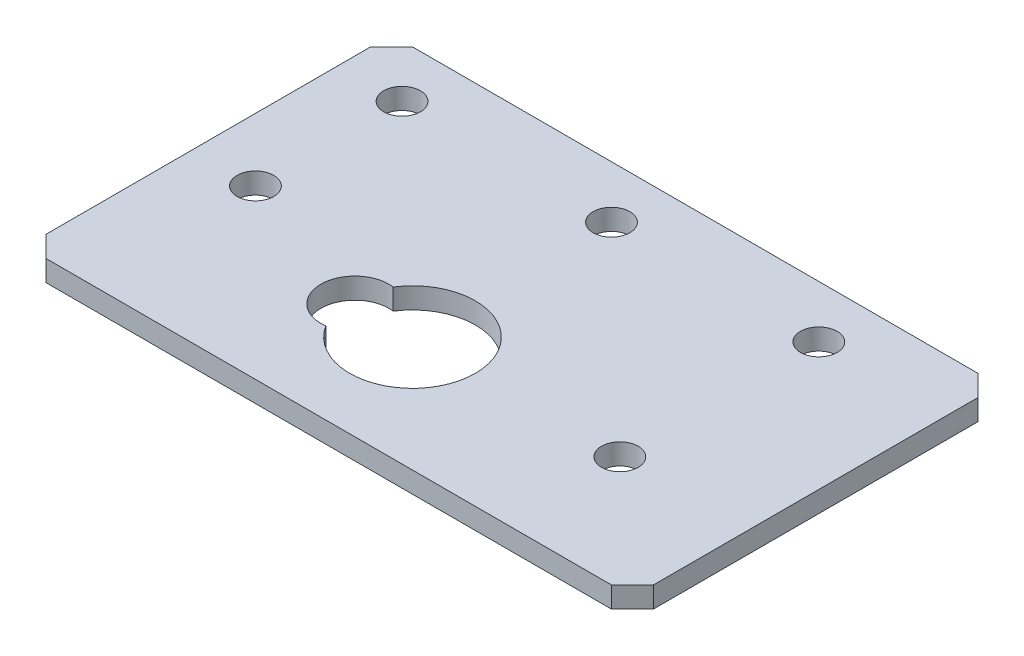
from build123d import *

# Parameters (mm, degrees)
SKETCH1_W                      = 58
SKETCH1_H                      = 35
BOSS_EXTRUDE1_DEPTH            = 2
M3X0_5_TAPPED_HOLE1_AT_2_COUNT = 2
M3X0_5_TAPPED_HOLE1_AT_2_PITCH = 20
M3X0_5_TAPPED_HOLE1_AT_3_COUNT = 2
M3X0_5_TAPPED_HOLE1_AT_3_PITCH = 39.8
M3X0_5_TAPPED_HOLE1_AT_4_COUNT = 2
M3X0_5_TAPPED_HOLE1_AT_4_PITCH = 44.102607633
M3X0_5_TAPPED_HOLE1_AT_5_COUNT = 2
M3X0_5_TAPPED_HOLE1_AT_5_PITCH = 14
CUT_EXTRUDE1_DEPTH             = 34.930075155
CHAMFER1_SIZE                  = 2


with BuildPart() as part:
    # Sketch1 → Boss-Extrude1 (new body)
    with BuildSketch(Plane(origin=(0, 0, 0), x_dir=(1, 0, 0), z_dir=(0, 1, 0))):
        Rectangle(SKETCH1_W, SKETCH1_H)
    extrude(amount=BOSS_EXTRUDE1_DEPTH)

    # Sketch3 → M3x0.5 Tapped Hole1 (revolve, cut)
    with BuildSketch(Plane(origin=(-23, 2, -12.5), x_dir=(0, 0, 1), z_dir=(1, 0, 0))):
        Polygon((0, 0), (0, 2), (1.75, 2), (1.75, -0.225), (1.525, 0), align=None)
    m3x0_5_tapped_hole1 = revolve(axis=Axis((-23, 8.35, -12.5), (0, -1, 0)), mode=Mode.SUBTRACT)

    # M3x0.5 Tapped Hole1 at 2: M3x0.5 Tapped Hole1 ×2
    with Locations(*[(i * M3X0_5_TAPPED_HOLE1_AT_2_PITCH, 0, 0) for i in range(1, M3X0_5_TAPPED_HOLE1_AT_2_COUNT)]):
        add(m3x0_5_tapped_hole1, mode=Mode.SUBTRACT)

    # M3x0.5 Tapped Hole1 at 3: M3x0.5 Tapped Hole1 ×2
    with Locations(*[(i * M3X0_5_TAPPED_HOLE1_AT_3_PITCH, 0, 0) for i in range(1, M3X0_5_TAPPED_HOLE1_AT_3_COUNT)]):
        add(m3x0_5_tapped_hole1, mode=Mode.SUBTRACT)

    # M3x0.5 Tapped Hole1 at 4: M3x0.5 Tapped Hole1 ×2
    with Locations(*[Vector(0.9024409697382602, 0, 0.4308135282670086) * (i * M3X0_5_TAPPED_HOLE1_AT_4_PITCH) for i in range(1, M3X0_5_TAPPED_HOLE1_AT_4_COUNT)]):
        add(m3x0_5_tapped_hole1, mode=Mode.SUBTRACT)

    # M3x0.5 Tapped Hole1 at 5: M3x0.5 Tapped Hole1 ×2
    with Locations(*[(0, 0, i * M3X0_5_TAPPED_HOLE1_AT_5_PITCH) for i in range(1, M3X0_5_TAPPED_HOLE1_AT_5_COUNT)]):
        add(m3x0_5_tapped_hole1, mode=Mode.SUBTRACT)

    # Sketch4 → Cut-Extrude1 (cut, through all)
    with BuildSketch(Plane(origin=(0, 2, 0), x_dir=(1, 0, 0), z_dir=(0, 1, 0))):
        with BuildLine():
            ThreePointArc((-8.0625, -3.279581743), (-11.75, -6.5), (-8.0625, -9.720418257))
            ThreePointArc((-8.0625, -9.720418257), (3, -6.5), (-8.0625, -3.279581743))
        make_face()
    extrude(amount=-CUT_EXTRUDE1_DEPTH, mode=Mode.SUBTRACT)

    # Chamfer1
    chamfer1_edges = [part.edges().sort_by_distance(p)[0] for p in [
        (29, 1, 17.5),
        (-29, 1, 17.5),
        (-29, 1, -17.5),
        (29, 1, -17.5),
    ]]
    chamfer(chamfer1_edges, length=CHAMFER1_SIZE)


solid = part.part
